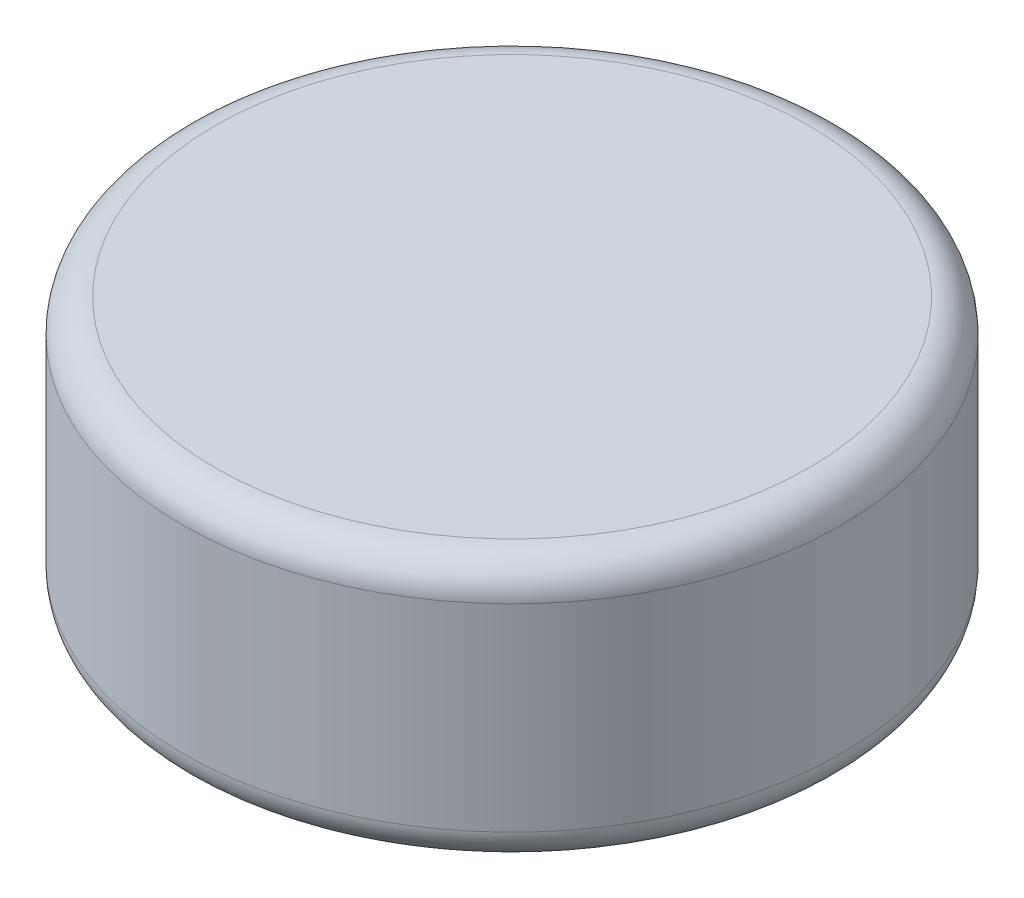
from build123d import *

# Parameters (mm, degrees)
SKETCH1_R           = 2.5
BOSS_EXTRUDE1_DEPTH = 2
FILLET1_R           = 0.25


with BuildPart() as part:
    # Sketch1 → Boss-Extrude1 (new body)
    with BuildSketch(Plane(origin=(0, 0, 0), x_dir=(1, 0, 0), z_dir=(0, 1, 0))):
        with Locations(Location((0, 0, 0), (0, 0, 270))):
            Circle(SKETCH1_R)
    extrude(amount=BOSS_EXTRUDE1_DEPTH)

    # Fillet1
    fillet1_edges = [part.edges().sort_by_distance(p)[0] for p in [
        (0, 0, -2.5),
        (0, 2, -2.5),
    ]]
    fillet(fillet1_edges, radius=FILLET1_R)


solid = part.part
